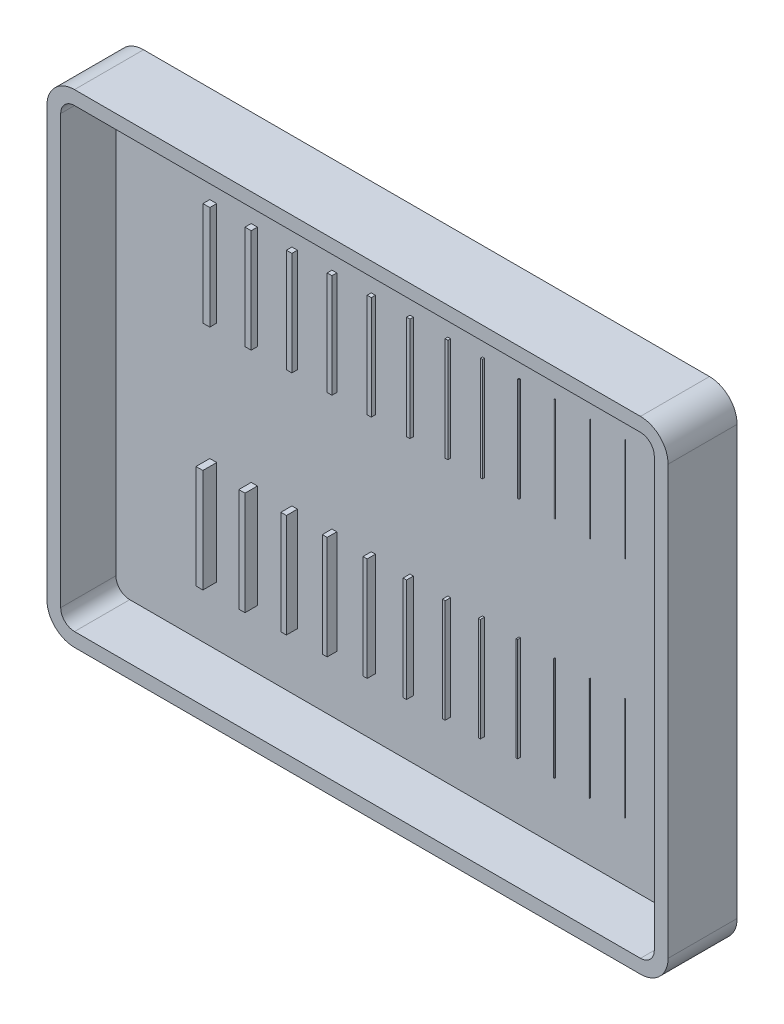
from build123d import *

# Parameters (mm, degrees)
SKETCH1_W            = 90
SKETCH1_H            = 70
BOSS_EXTRUDE1_DEPTH  = 10
FILLET1_R            = 4
SHELL1_T             = -2
SKETCH2_W            = 1
SKETCH2_H            = 15
BOSS_EXTRUDE2_DEPTH  = 1
SKETCH3_W            = 0.9
SKETCH3_H            = 15
BOSS_EXTRUDE3_DEPTH  = 0.9
SKETCH4_W            = 0.8
SKETCH4_H            = 15
BOSS_EXTRUDE4_DEPTH  = 0.8
SKETCH5_W            = 0.7
SKETCH5_H            = 15
BOSS_EXTRUDE5_DEPTH  = 0.7
SKETCH6_W            = 0.6
SKETCH6_H            = 15
BOSS_EXTRUDE6_DEPTH  = 0.6
SKETCH7_W            = 0.5
SKETCH7_H            = 15
BOSS_EXTRUDE7_DEPTH  = 0.5
SKETCH8_W            = 0.4
SKETCH8_H            = 15
BOSS_EXTRUDE8_DEPTH  = 0.4
SKETCH9_W            = 0.3
SKETCH9_H            = 15
BOSS_EXTRUDE9_DEPTH  = 0.3
SKETCH10_W           = 0.2
SKETCH10_H           = 15
BOSS_EXTRUDE10_DEPTH = 0.2
SKETCH11_W           = 0.1
SKETCH11_H           = 15
BOSS_EXTRUDE11_DEPTH = 0.1
SKETCH12_W           = 0.075
SKETCH12_H           = 15
BOSS_EXTRUDE12_DEPTH = 0.075
SKETCH14_W           = 0.05
SKETCH14_H           = 15
BOSS_EXTRUDE13_DEPTH = 0.05
SKETCH15_W           = 1
SKETCH15_H           = 15
BOSS_EXTRUDE14_DEPTH = 2
SKETCH17_W           = 0.9
SKETCH17_H           = 15
BOSS_EXTRUDE15_DEPTH = 1.8
SKETCH18_W           = 0.8
SKETCH18_H           = 15
BOSS_EXTRUDE16_DEPTH = 1.6
SKETCH19_W           = 0.7
SKETCH19_H           = 15
BOSS_EXTRUDE17_DEPTH = 1.4
SKETCH20_W           = 0.6
SKETCH20_H           = 15
BOSS_EXTRUDE18_DEPTH = 1.2
SKETCH21_W           = 0.5
SKETCH21_H           = 15
BOSS_EXTRUDE19_DEPTH = 1
SKETCH22_W           = 0.4
SKETCH22_H           = 15
BOSS_EXTRUDE20_DEPTH = 0.8
SKETCH23_W           = 0.3
SKETCH23_H           = 15
BOSS_EXTRUDE21_DEPTH = 0.6
SKETCH24_W           = 0.2
SKETCH24_H           = 15
BOSS_EXTRUDE22_DEPTH = 0.4
SKETCH25_W           = 0.1
SKETCH25_H           = 15
BOSS_EXTRUDE23_DEPTH = 0.2
SKETCH27_W           = 0.075
SKETCH27_H           = 15
BOSS_EXTRUDE24_DEPTH = 0.15
SKETCH28_W           = 0.05
SKETCH28_H           = 15
BOSS_EXTRUDE25_DEPTH = 0.1


with BuildPart() as part:
    # Sketch1 → Boss-Extrude1 (new body)
    with BuildSketch(Plane.XY):
        with Locations((45, 35)):
            Rectangle(SKETCH1_W, SKETCH1_H)
    extrude(amount=BOSS_EXTRUDE1_DEPTH)

    # Fillet1
    fillet1_edges = [part.edges().sort_by_distance(p)[0] for p in [
        (0, 70, 5),
        (90, 70, 5),
        (90, 0, 5),
        (0, 0, 5),
    ]]
    fillet(fillet1_edges, radius=FILLET1_R)

    # Shell1
    shell1_openings = [part.faces().sort_by_distance(p)[0] for p in [
        (45, 35, 10),
    ]]
    offset(amount=SHELL1_T, openings=shell1_openings, kind=Kind.INTERSECTION)

    # Sketch2 → Boss-Extrude2 (add)
    with BuildSketch(Plane.XY.offset(2)):
        with Locations((16.1, 50.5)):
            Rectangle(SKETCH2_W, SKETCH2_H)
    extrude(amount=BOSS_EXTRUDE2_DEPTH)

    # Sketch3 → Boss-Extrude3 (add)
    with BuildSketch(Plane.XY.offset(2)):
        with Locations((22.05, 50.5)):
            Rectangle(SKETCH3_W, SKETCH3_H)
    extrude(amount=BOSS_EXTRUDE3_DEPTH)

    # Sketch4 → Boss-Extrude4 (add)
    with BuildSketch(Plane.XY.offset(2)):
        with Locations((27.9, 50.5)):
            Rectangle(SKETCH4_W, SKETCH4_H)
    extrude(amount=BOSS_EXTRUDE4_DEPTH)

    # Sketch5 → Boss-Extrude5 (add)
    with BuildSketch(Plane.XY.offset(2)):
        with Locations((33.65, 50.5)):
            Rectangle(SKETCH5_W, SKETCH5_H)
    extrude(amount=BOSS_EXTRUDE5_DEPTH)

    # Sketch6 → Boss-Extrude6 (add)
    with BuildSketch(Plane.XY.offset(2)):
        with Locations((39.3, 50.5)):
            Rectangle(SKETCH6_W, SKETCH6_H)
    extrude(amount=BOSS_EXTRUDE6_DEPTH)

    # Sketch7 → Boss-Extrude7 (add)
    with BuildSketch(Plane.XY.offset(2)):
        with Locations((44.85, 50.5)):
            Rectangle(SKETCH7_W, SKETCH7_H)
    extrude(amount=BOSS_EXTRUDE7_DEPTH)

    # Sketch8 → Boss-Extrude8 (add)
    with BuildSketch(Plane.XY.offset(2)):
        with Locations((50.3, 50.5)):
            Rectangle(SKETCH8_W, SKETCH8_H)
    extrude(amount=BOSS_EXTRUDE8_DEPTH)

    # Sketch9 → Boss-Extrude9 (add)
    with BuildSketch(Plane.XY.offset(2)):
        with Locations((55.25, 50.5)):
            Rectangle(SKETCH9_W, SKETCH9_H)
    extrude(amount=BOSS_EXTRUDE9_DEPTH)

    # Sketch10 → Boss-Extrude10 (add)
    with BuildSketch(Plane.XY.offset(2)):
        with Locations((60.5, 50.5)):
            Rectangle(SKETCH10_W, SKETCH10_H)
    extrude(amount=BOSS_EXTRUDE10_DEPTH)

    # Sketch11 → Boss-Extrude11 (add)
    with BuildSketch(Plane.XY.offset(2)):
        with Locations((65.65, 50.5)):
            Rectangle(SKETCH11_W, SKETCH11_H)
    extrude(amount=BOSS_EXTRUDE11_DEPTH)

    # Sketch12 → Boss-Extrude12 (add)
    with BuildSketch(Plane.XY.offset(2)):
        with Locations((70.7375, 50.5)):
            Rectangle(SKETCH12_W, SKETCH12_H)
    extrude(amount=BOSS_EXTRUDE12_DEPTH)

    # Sketch14 → Boss-Extrude13 (add)
    with BuildSketch(Plane.XY.offset(2)):
        with Locations((75.8, 50.5)):
            Rectangle(SKETCH14_W, SKETCH14_H)
    extrude(amount=BOSS_EXTRUDE13_DEPTH)

    # Sketch15 → Boss-Extrude14 (add)
    with BuildSketch(Plane.XY.offset(2)):
        with Locations((16.1, 18.013180638)):
            Rectangle(SKETCH15_W, SKETCH15_H)
    extrude(amount=BOSS_EXTRUDE14_DEPTH)

    # Sketch17 → Boss-Extrude15 (add)
    with BuildSketch(Plane.XY.offset(2)):
        with Locations((22.05, 18.013180638)):
            Rectangle(SKETCH17_W, SKETCH17_H)
    extrude(amount=BOSS_EXTRUDE15_DEPTH)

    # Sketch18 → Boss-Extrude16 (add)
    with BuildSketch(Plane.XY.offset(2)):
        with Locations((27.9, 18.013180638)):
            Rectangle(SKETCH18_W, SKETCH18_H)
    extrude(amount=BOSS_EXTRUDE16_DEPTH)

    # Sketch19 → Boss-Extrude17 (add)
    with BuildSketch(Plane.XY.offset(2)):
        with Locations((33.65, 18.013180638)):
            Rectangle(SKETCH19_W, SKETCH19_H)
    extrude(amount=BOSS_EXTRUDE17_DEPTH)

    # Sketch20 → Boss-Extrude18 (add)
    with BuildSketch(Plane.XY.offset(2)):
        with Locations((39.3, 18.013180638)):
            Rectangle(SKETCH20_W, SKETCH20_H)
    extrude(amount=BOSS_EXTRUDE18_DEPTH)

    # Sketch21 → Boss-Extrude19 (add)
    with BuildSketch(Plane.XY.offset(2)):
        with Locations((44.85, 18.013180638)):
            Rectangle(SKETCH21_W, SKETCH21_H)
    extrude(amount=BOSS_EXTRUDE19_DEPTH)

    # Sketch22 → Boss-Extrude20 (add)
    with BuildSketch(Plane.XY.offset(2)):
        with Locations((50.3, 18.013180638)):
            Rectangle(SKETCH22_W, SKETCH22_H)
    extrude(amount=BOSS_EXTRUDE20_DEPTH)

    # Sketch23 → Boss-Extrude21 (add)
    with BuildSketch(Plane.XY.offset(2)):
        with Locations((55.25, 18.013180638)):
            Rectangle(SKETCH23_W, SKETCH23_H)
    extrude(amount=BOSS_EXTRUDE21_DEPTH)

    # Sketch24 → Boss-Extrude22 (add)
    with BuildSketch(Plane.XY.offset(2)):
        with Locations((60.5, 18.013180638)):
            Rectangle(SKETCH24_W, SKETCH24_H)
    extrude(amount=BOSS_EXTRUDE22_DEPTH)

    # Sketch25 → Boss-Extrude23 (add)
    with BuildSketch(Plane.XY.offset(2)):
        with Locations((65.65, 18.013180638)):
            Rectangle(SKETCH25_W, SKETCH25_H)
    extrude(amount=BOSS_EXTRUDE23_DEPTH)

    # Sketch27 → Boss-Extrude24 (add)
    with BuildSketch(Plane.XY.offset(2)):
        with Locations((70.7375, 18.013180638)):
            Rectangle(SKETCH27_W, SKETCH27_H)
    extrude(amount=BOSS_EXTRUDE24_DEPTH)

    # Sketch28 → Boss-Extrude25 (add)
    with BuildSketch(Plane.XY.offset(2)):
        with Locations((75.8, 18.013180638)):
            Rectangle(SKETCH28_W, SKETCH28_H)
    extrude(amount=BOSS_EXTRUDE25_DEPTH)


solid = part.part
